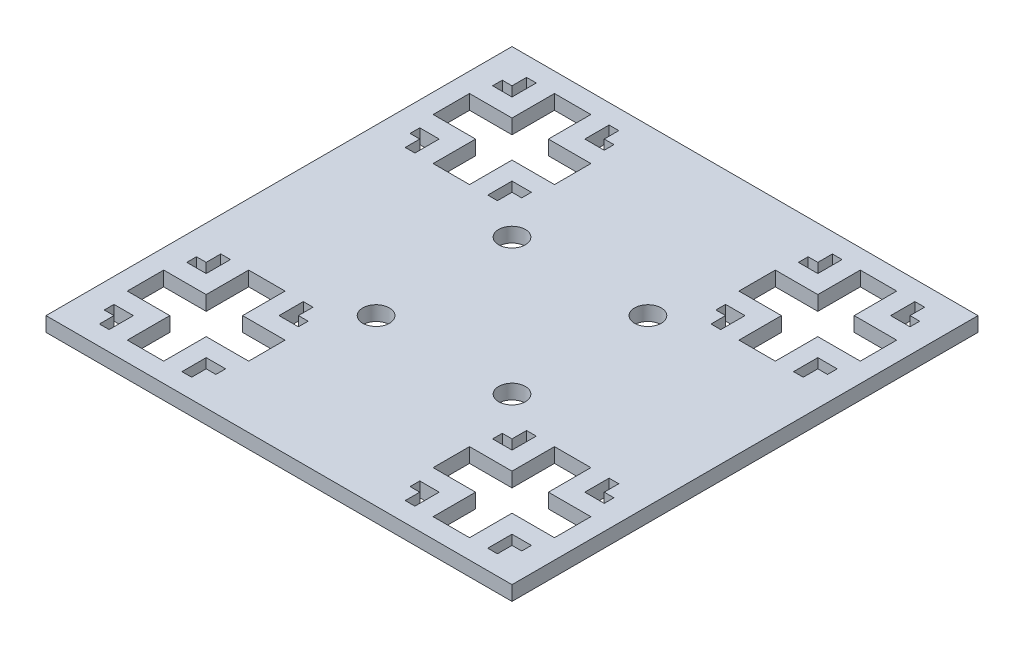
from build123d import *

# Parameters (mm, degrees)
SKETCH_1_W               = 96
SKETCH_1_H               = 96
EXTRUDE_1_DEPTH          = 3
CUT_EXTRUDE_1_REACH      = 69.949
SKETCH_3_R               = 2.75
MIRROR_2_COPY_1_REACH    = 69.949
MIRROR_2_COPY_1_SKETCH_R = 2.75


with BuildPart() as part:
    # 草图1 → 凸台-拉伸1 (new body)
    with BuildSketch(Plane(origin=(0, 0, 0), x_dir=(1, 0, 0), z_dir=(0, 1, 0))):
        Rectangle(SKETCH_1_W, SKETCH_1_H)
    extrude(amount=EXTRUDE_1_DEPTH)

    # 草图3 → 切除-拉伸1 (cut, up to next)
    with BuildSketch(Plane(origin=(0, 3, 0), x_dir=(1, 0, 0), z_dir=(0, 1, 0)), mode=Mode.PRIVATE) as cut_extrude_1_sk1:
        with Locations(Location((-14, 14, 0), (0, 0, 270))):
            Circle(SKETCH_3_R)
    cut_extrude_1_tool1 = extrude(cut_extrude_1_sk1.sketch, amount=-CUT_EXTRUDE_1_REACH, mode=Mode.PRIVATE) & part.part
    # 草图3 → 切除-拉伸1 (cut, up to next)
    with BuildSketch(Plane(origin=(0, 3, 0), x_dir=(1, 0, 0), z_dir=(0, 1, 0)), mode=Mode.PRIVATE) as cut_extrude_1_sk2:
        Polygon((-27.75, 35.25), (-19, 35.25), (-19, 27.75), (-27.75, 27.75), (-27.75, 19), (-35.25, 19), (-35.25, 27.75), (-44, 27.75), (-44, 35.25), (-35.25, 35.25), (-35.25, 44), (-27.75, 44), align=None)
    cut_extrude_1_tool2 = extrude(cut_extrude_1_sk2.sketch, amount=-CUT_EXTRUDE_1_REACH, mode=Mode.PRIVATE) & part.part
    # 草图3 → 切除-拉伸1 (cut, up to next)
    with BuildSketch(Plane(origin=(0, 3, 0), x_dir=(1, 0, 0), z_dir=(0, 1, 0)), mode=Mode.PRIVATE) as cut_extrude_1_sk3:
        Polygon((-41, 44), (-39, 44), (-39, 39), (-43, 39), (-43, 41), (-41, 41), align=None)
    cut_extrude_1_tool3 = extrude(cut_extrude_1_sk3.sketch, amount=-CUT_EXTRUDE_1_REACH, mode=Mode.PRIVATE) & part.part
    # 草图3 → 切除-拉伸1 (cut, up to next)
    with BuildSketch(Plane(origin=(0, 3, 0), x_dir=(1, 0, 0), z_dir=(0, 1, 0)), mode=Mode.PRIVATE) as cut_extrude_1_sk4:
        Polygon((-22, 41), (-22, 44), (-24, 44), (-24, 39), (-20, 39), (-20, 41), align=None)
    cut_extrude_1_tool4 = extrude(cut_extrude_1_sk4.sketch, amount=-CUT_EXTRUDE_1_REACH, mode=Mode.PRIVATE) & part.part
    # 草图3 → 切除-拉伸1 (cut, up to next)
    with BuildSketch(Plane(origin=(0, 3, 0), x_dir=(1, 0, 0), z_dir=(0, 1, 0)), mode=Mode.PRIVATE) as cut_extrude_1_sk5:
        Polygon((-22, 19), (-24, 19), (-24, 24), (-20, 24), (-20, 22), (-22, 22), align=None)
    cut_extrude_1_tool5 = extrude(cut_extrude_1_sk5.sketch, amount=-CUT_EXTRUDE_1_REACH, mode=Mode.PRIVATE) & part.part
    # 草图3 → 切除-拉伸1 (cut, up to next)
    with BuildSketch(Plane(origin=(0, 3, 0), x_dir=(1, 0, 0), z_dir=(0, 1, 0)), mode=Mode.PRIVATE) as cut_extrude_1_sk6:
        Polygon((-41, 22), (-41, 19), (-39, 19), (-39, 24), (-43, 24), (-43, 22), align=None)
    cut_extrude_1_tool6 = extrude(cut_extrude_1_sk6.sketch, amount=-CUT_EXTRUDE_1_REACH, mode=Mode.PRIVATE) & part.part
    cut_extrude_1_1 = cut_extrude_1_tool1.solids().sort_by_distance((-14, 3, -14))[0]
    add(cut_extrude_1_1, mode=Mode.SUBTRACT)
    cut_extrude_1_2 = cut_extrude_1_tool2.solids().sort_by_distance((-31.5, 3, -31.5))[0]
    add(cut_extrude_1_2, mode=Mode.SUBTRACT)
    cut_extrude_1_3 = cut_extrude_1_tool3.solids().sort_by_distance((-40.571429, 3, -41.071429))[0]
    add(cut_extrude_1_3, mode=Mode.SUBTRACT)
    cut_extrude_1_4 = cut_extrude_1_tool4.solids().sort_by_distance((-22.428571, 3, -41.071429))[0]
    add(cut_extrude_1_4, mode=Mode.SUBTRACT)
    cut_extrude_1_5 = cut_extrude_1_tool5.solids().sort_by_distance((-22.428571, 3, -21.928571))[0]
    add(cut_extrude_1_5, mode=Mode.SUBTRACT)
    cut_extrude_1_6 = cut_extrude_1_tool6.solids().sort_by_distance((-40.571429, 3, -21.928571))[0]
    add(cut_extrude_1_6, mode=Mode.SUBTRACT)
    cut_extrude_1 = cut_extrude_1_1 + cut_extrude_1_2 + cut_extrude_1_3 + cut_extrude_1_4 + cut_extrude_1_5 + cut_extrude_1_6  # 切除-拉伸1 as one shape, for the pattern or mirror that repeats it

    # 镜向1: 切除-拉伸1 across plane
    add(cut_extrude_1.mirror(Plane(origin=(0, 0, 0), x_dir=(0, 0, 1), z_dir=(1, 0, 0))), mode=Mode.SUBTRACT)

    # 镜向2: 切除-拉伸1 across plane
    add(cut_extrude_1.mirror(Plane.XY), mode=Mode.SUBTRACT)

    # 镜向2 copy 1 sketch → 镜向2 copy 1 (cut, up to next)
    with BuildSketch(Plane(origin=(0, 3, 0), x_dir=(-1, 0, 0), z_dir=(0, 1, 0)), mode=Mode.PRIVATE) as mirror_2_copy_1_sk1:
        with Locations(Location((-14, 14, 0), (0, 0, 270))):
            Circle(MIRROR_2_COPY_1_SKETCH_R)
    mirror_2_copy_1_tool1 = extrude(mirror_2_copy_1_sk1.sketch, amount=-MIRROR_2_COPY_1_REACH, mode=Mode.PRIVATE) & part.part
    # 镜向2 copy 1 sketch → 镜向2 copy 1 (cut, up to next)
    with BuildSketch(Plane(origin=(0, 3, 0), x_dir=(-1, 0, 0), z_dir=(0, 1, 0)), mode=Mode.PRIVATE) as mirror_2_copy_1_sk2:
        Polygon((-27.75, 35.25), (-19, 35.25), (-19, 27.75), (-27.75, 27.75), (-27.75, 19), (-35.25, 19), (-35.25, 27.75), (-44, 27.75), (-44, 35.25), (-35.25, 35.25), (-35.25, 44), (-27.75, 44), align=None)
    mirror_2_copy_1_tool2 = extrude(mirror_2_copy_1_sk2.sketch, amount=-MIRROR_2_COPY_1_REACH, mode=Mode.PRIVATE) & part.part
    # 镜向2 copy 1 sketch → 镜向2 copy 1 (cut, up to next)
    with BuildSketch(Plane(origin=(0, 3, 0), x_dir=(-1, 0, 0), z_dir=(0, 1, 0)), mode=Mode.PRIVATE) as mirror_2_copy_1_sk3:
        Polygon((-41, 44), (-39, 44), (-39, 39), (-43, 39), (-43, 41), (-41, 41), align=None)
    mirror_2_copy_1_tool3 = extrude(mirror_2_copy_1_sk3.sketch, amount=-MIRROR_2_COPY_1_REACH, mode=Mode.PRIVATE) & part.part
    # 镜向2 copy 1 sketch → 镜向2 copy 1 (cut, up to next)
    with BuildSketch(Plane(origin=(0, 3, 0), x_dir=(-1, 0, 0), z_dir=(0, 1, 0)), mode=Mode.PRIVATE) as mirror_2_copy_1_sk4:
        Polygon((-22, 41), (-22, 44), (-24, 44), (-24, 39), (-20, 39), (-20, 41), align=None)
    mirror_2_copy_1_tool4 = extrude(mirror_2_copy_1_sk4.sketch, amount=-MIRROR_2_COPY_1_REACH, mode=Mode.PRIVATE) & part.part
    # 镜向2 copy 1 sketch → 镜向2 copy 1 (cut, up to next)
    with BuildSketch(Plane(origin=(0, 3, 0), x_dir=(-1, 0, 0), z_dir=(0, 1, 0)), mode=Mode.PRIVATE) as mirror_2_copy_1_sk5:
        Polygon((-22, 19), (-24, 19), (-24, 24), (-20, 24), (-20, 22), (-22, 22), align=None)
    mirror_2_copy_1_tool5 = extrude(mirror_2_copy_1_sk5.sketch, amount=-MIRROR_2_COPY_1_REACH, mode=Mode.PRIVATE) & part.part
    # 镜向2 copy 1 sketch → 镜向2 copy 1 (cut, up to next)
    with BuildSketch(Plane(origin=(0, 3, 0), x_dir=(-1, 0, 0), z_dir=(0, 1, 0)), mode=Mode.PRIVATE) as mirror_2_copy_1_sk6:
        Polygon((-41, 22), (-41, 19), (-39, 19), (-39, 24), (-43, 24), (-43, 22), align=None)
    mirror_2_copy_1_tool6 = extrude(mirror_2_copy_1_sk6.sketch, amount=-MIRROR_2_COPY_1_REACH, mode=Mode.PRIVATE) & part.part
    add(mirror_2_copy_1_tool1.solids().sort_by_distance((14, 3, 14))[0], mode=Mode.SUBTRACT)
    add(mirror_2_copy_1_tool2.solids().sort_by_distance((31.5, 3, 31.5))[0], mode=Mode.SUBTRACT)
    add(mirror_2_copy_1_tool3.solids().sort_by_distance((40.571429, 3, 41.071429))[0], mode=Mode.SUBTRACT)
    add(mirror_2_copy_1_tool4.solids().sort_by_distance((22.428571, 3, 41.071429))[0], mode=Mode.SUBTRACT)
    add(mirror_2_copy_1_tool5.solids().sort_by_distance((22.428571, 3, 21.928571))[0], mode=Mode.SUBTRACT)
    add(mirror_2_copy_1_tool6.solids().sort_by_distance((40.571429, 3, 21.928571))[0], mode=Mode.SUBTRACT)


solid = part.part
